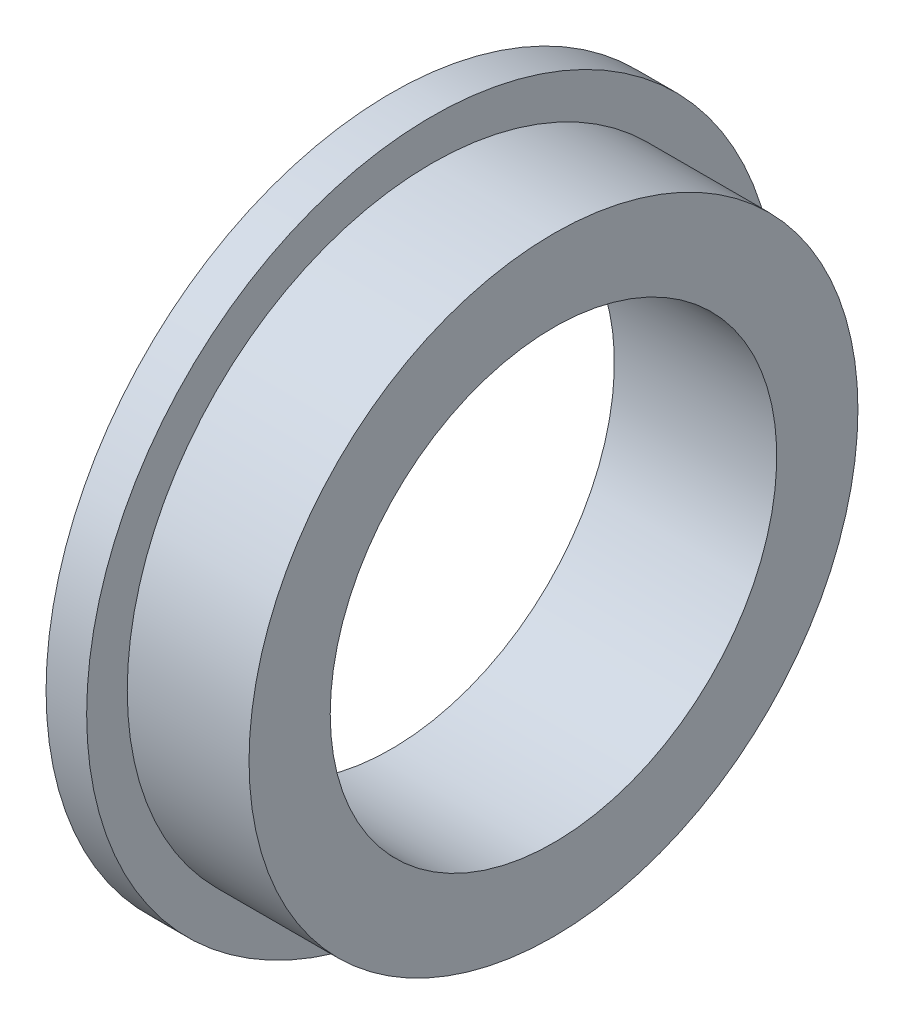
from build123d import *

# Parameters (mm, degrees)
SKETCH1_W   = 12.7
SKETCH1_H   = 6.35
SKETCH1_W_2 = 3.175
SKETCH1_H_2 = 3.175


with BuildPart() as part:
    # Sketch1 → Revolve1 (revolve)
    with BuildSketch(Plane.XY, mode=Mode.PRIVATE) as revolve1_sk:
        with Locations((3.175, 20.6375)):
            Rectangle(SKETCH1_W, SKETCH1_H)
        with Locations((-1.5875, 25.4)):
            Rectangle(SKETCH1_W_2, SKETCH1_H_2)
    revolve(revolve1_sk.sketch.rotate(Axis((-80.921826702, 0, 0), (1, 0, 0)), 90), axis=Axis((-80.921826702, 0, 0), (1, 0, 0)))


solid = part.part
